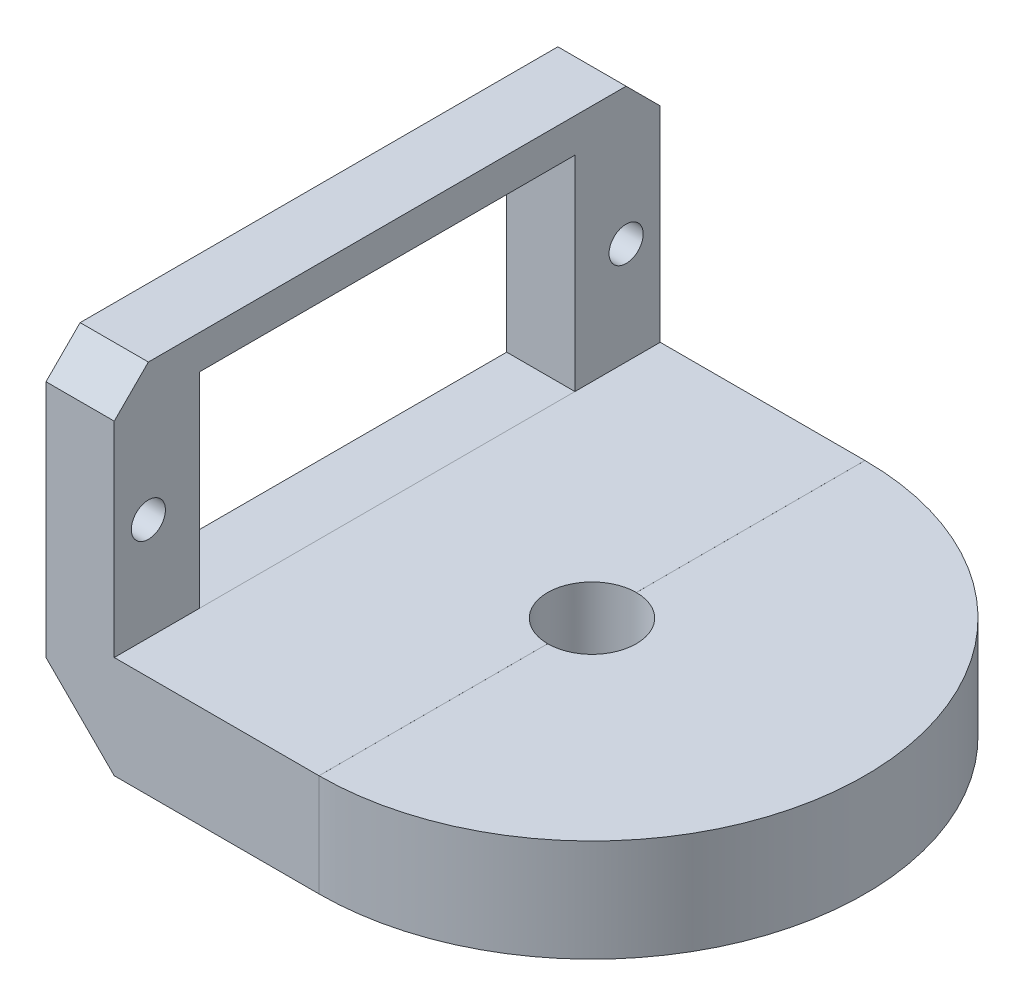
from build123d import *

# Parameters (mm, degrees)
SKETCH1_W                = 32
SKETCH1_H                = 16
SKETCH1_W_2              = 22
SKETCH1_H_2              = 12
BOSS_EXTRUDE1_DEPTH      = 4
SKETCH3_W                = 32
SKETCH3_H                = 2.001260946
BOSS_EXTRUDE3_DEPTH      = 12
BOSS_EXTRUDE5_DEPTH      = 4
BOSS_EXTRUDE5_DEPTH_BACK = 2
CHAMFER1_SIZE            = 4
SKETCH8_R                = 2.6
CUT_EXTRUDE2_DEPTH       = 50.477267507
SKETCH9_R                = 1
CUT_EXTRUDE3_DEPTH       = 49
CHAMFER2_SIZE            = 2


with BuildPart() as part:
    # Sketch1 → Boss-Extrude1 (new body)
    with BuildSketch(Plane(origin=(0, 0, 0), x_dir=(0, 0, -1), z_dir=(1, 0, 0))):
        with Locations((16, 8)):
            Rectangle(SKETCH1_W, SKETCH1_H)
        with Locations((16, 8)):
            Rectangle(SKETCH1_W_2, SKETCH1_H_2, mode=Mode.SUBTRACT)
    extrude(amount=BOSS_EXTRUDE1_DEPTH)

    # Sketch3 → Boss-Extrude3 (add)
    with BuildSketch(Plane(origin=(4, 0, 0), x_dir=(0, 0, -1), z_dir=(1, 0, 0))):
        with Locations((16, 1.000630473)):
            Rectangle(SKETCH3_W, SKETCH3_H)
    extrude(amount=BOSS_EXTRUDE3_DEPTH)

    # Sketch7 → Boss-Extrude5 (add, two sides: drawn at the far end of the back side and taken through both)
    with BuildSketch(Plane.XZ.offset(-BOSS_EXTRUDE5_DEPTH_BACK)):
        with BuildLine():
            Line((0, 0), (16, 0))
            ThreePointArc((16, 0), (32, -16), (16, -32))
            Line((16, -32), (0, -32))
            Line((0, -32), (0, 0))
        make_face()
    extrude(amount=BOSS_EXTRUDE5_DEPTH + BOSS_EXTRUDE5_DEPTH_BACK)

    # Chamfer1
    chamfer1_edges = [part.edges().sort_by_distance(p)[0] for p in [
        (0, -4, -16),
    ]]
    chamfer(chamfer1_edges, length=CHAMFER1_SIZE)

    # Sketch8 → Cut-Extrude2 (cut, through all)
    with BuildSketch(Plane.XZ.offset(4)):
        with Locations(Location((16, -16, 0), (0, 0, 270))):
            Circle(SKETCH8_R)
    extrude(amount=-CUT_EXTRUDE2_DEPTH, mode=Mode.SUBTRACT)

    # Sketch9 → Cut-Extrude3 (cut, through all)
    with BuildSketch(Plane.ZY):
        with Locations((-30, 8)):
            Circle(SKETCH9_R)
        with Locations((-2, 8)):
            Circle(SKETCH9_R)
    extrude(amount=-CUT_EXTRUDE3_DEPTH, mode=Mode.SUBTRACT)

    # Chamfer2
    chamfer2_edges = [part.edges().sort_by_distance(p)[0] for p in [
        (2, 16, 0),
        (2, 16, -32),
    ]]
    chamfer(chamfer2_edges, length=CHAMFER2_SIZE)


solid = part.part
